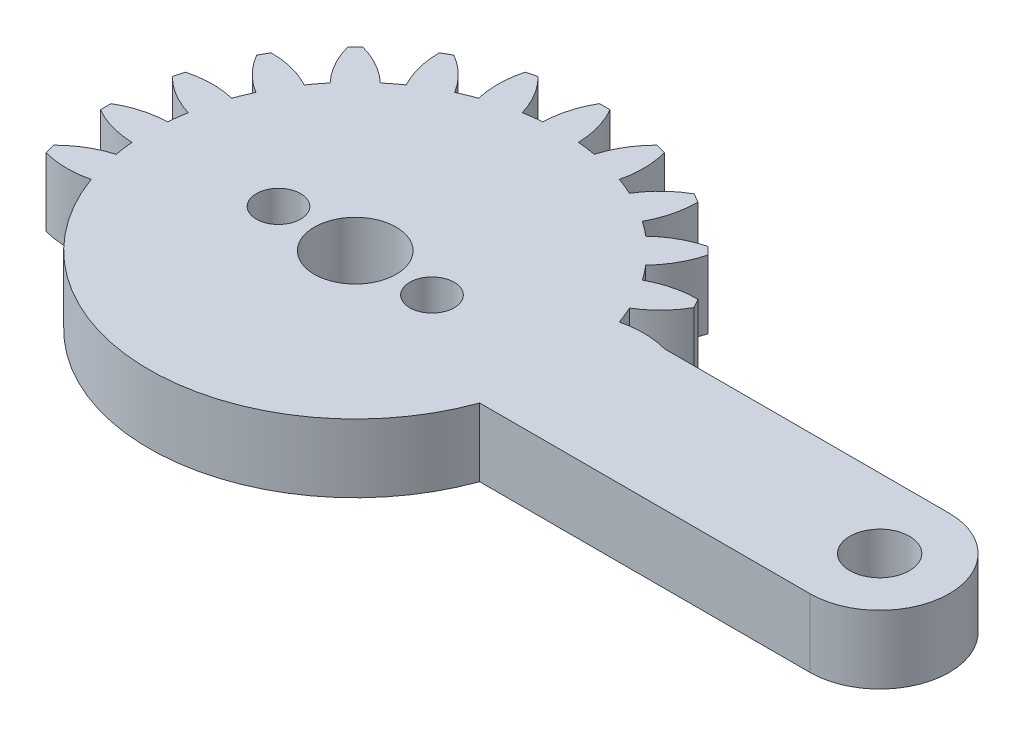
from build123d import *

# Parameters (mm, degrees)
SKETCH_2_R          = 1.75
EXTRUDE_1_DEPTH     = 4
SKETCH_3_R          = 2.4
SKETCH_3_R_2        = 1.3
CUT_EXTRUDE_1_DEPTH = 38.993706757


with BuildPart() as part:
    # 草图2 → 凸台-拉伸1 (new body)
    with BuildSketch(Plane(origin=(0, 0, 0), x_dir=(1, 0, 0), z_dir=(0, 1, 0))):
        with BuildLine():
            ThreePointArc((30.75, -4.085109489), (34.835109489, 0), (30.75, 4.085109489))
            Line((30.75, 4.085109489), (14.048088143, 4.085109489))
            ThreePointArc((14.048088143, 4.085109489), (12.709169027, 4.272836063), (11.365584201, 4.122086336))
            ThreePointArc((11.365584201, 4.122086336), (11.169703548, 4.626642697), (10.951436862, 5.12192646))
            ThreePointArc((10.951436862, 5.12192646), (12.008090957, 5.965388247), (12.82210701, 7.044889767))
            ThreePointArc((12.82210701, 7.044889767), (12.669951657, 7.315), (12.51210701, 7.581825517))
            ThreePointArc((12.51210701, 7.581825517), (11.170223244, 7.416617696), (9.911436862, 6.9232593))
            ThreePointArc((9.911436862, 6.9232593), (9.591641884, 7.359925677), (9.252623584, 7.781841479))
            ThreePointArc((9.252623584, 7.781841479), (10.05496909, 8.870045207), (10.561852666, 10.123446462))
            ThreePointArc((10.561852666, 10.123446462), (10.344972209, 10.344972209), (10.123446462, 10.561852666))
            ThreePointArc((10.123446462, 10.561852666), (8.870045207, 10.05496909), (7.781841479, 9.252623584))
            ThreePointArc((7.781841479, 9.252623584), (7.359925677, 9.591641884), (6.9232593, 9.911436862))
            ThreePointArc((6.9232593, 9.911436862), (7.416617696, 11.170223244), (7.581825517, 12.51210701))
            ThreePointArc((7.581825517, 12.51210701), (7.315, 12.669951657), (7.044889767, 12.82210701))
            ThreePointArc((7.044889767, 12.82210701), (5.965388247, 12.008090957), (5.12192646, 10.951436862))
            ThreePointArc((5.12192646, 10.951436862), (4.626642697, 11.169703548), (4.122086336, 11.365584201))
            ThreePointArc((4.122086336, 11.365584201), (4.272836063, 12.709169027), (4.085109489, 14.048088143))
            ThreePointArc((4.085109489, 14.048088143), (3.78652263, 14.131494839), (3.486235477, 14.208555951))
            ThreePointArc((3.486235477, 14.208555951), (2.654199937, 13.14288127), (2.112960617, 11.903927815))
            ThreePointArc((2.112960617, 11.903927815), (1.578061664, 11.986568374), (1.04, 12.04518576))
            ThreePointArc((1.04, 12.04518576), (0.837867713, 13.382005944), (0.31, 14.626715284))
            ThreePointArc((0.31, 14.626715284), (0, 14.63), (-0.31, 14.626715284))
            ThreePointArc((-0.31, 14.626715284), (-0.837867713, 13.382005944), (-1.04, 12.04518576))
            ThreePointArc((-1.04, 12.04518576), (-1.578061664, 11.986568374), (-2.112960617, 11.903927815))
            ThreePointArc((-2.112960617, 11.903927815), (-2.654199937, 13.14288127), (-3.486235477, 14.208555951))
            ThreePointArc((-3.486235477, 14.208555951), (-3.78652263, 14.131494839), (-4.085109489, 14.048088143))
            ThreePointArc((-4.085109489, 14.048088143), (-4.272836063, 12.709169027), (-4.122086336, 11.365584201))
            ThreePointArc((-4.122086336, 11.365584201), (-4.626642697, 11.169703548), (-5.12192646, 10.951436862))
            ThreePointArc((-5.12192646, 10.951436862), (-5.965388247, 12.008090957), (-7.044889767, 12.82210701))
            ThreePointArc((-7.044889767, 12.82210701), (-7.315, 12.669951657), (-7.581825517, 12.51210701))
            ThreePointArc((-7.581825517, 12.51210701), (-7.416617696, 11.170223244), (-6.9232593, 9.911436862))
            ThreePointArc((-6.9232593, 9.911436862), (-7.359925677, 9.591641884), (-7.781841479, 9.252623584))
            ThreePointArc((-7.781841479, 9.252623584), (-8.870045207, 10.05496909), (-10.123446462, 10.561852666))
            ThreePointArc((-10.123446462, 10.561852666), (-10.344972209, 10.344972209), (-10.561852666, 10.123446462))
            ThreePointArc((-10.561852666, 10.123446462), (-10.05496909, 8.870045207), (-9.252623584, 7.781841479))
            ThreePointArc((-9.252623584, 7.781841479), (-9.591641884, 7.359925677), (-9.911436862, 6.9232593))
            ThreePointArc((-9.911436862, 6.9232593), (-11.170223244, 7.416617696), (-12.51210701, 7.581825517))
            ThreePointArc((-12.51210701, 7.581825517), (-12.669951657, 7.315), (-12.82210701, 7.044889767))
            ThreePointArc((-12.82210701, 7.044889767), (-12.008090957, 5.965388247), (-10.951436862, 5.12192646))
            ThreePointArc((-10.951436862, 5.12192646), (-11.169703548, 4.626642697), (-11.365584201, 4.122086336))
            ThreePointArc((-11.365584201, 4.122086336), (-12.709169027, 4.272836063), (-14.048088143, 4.085109489))
            ThreePointArc((-14.048088143, 4.085109489), (-14.131494839, 3.78652263), (-14.208555951, 3.486235477))
            ThreePointArc((-14.208555951, 3.486235477), (-13.14288127, 2.654199937), (-11.903927815, 2.112960617))
            ThreePointArc((-11.903927815, 2.112960617), (-11.986568374, 1.578061664), (-12.04518576, 1.04))
            ThreePointArc((-12.04518576, 1.04), (-13.382005944, 0.837867713), (-14.626715284, 0.31))
            ThreePointArc((-14.626715284, 0.31), (-14.63, 0), (-14.626715284, -0.31))
            ThreePointArc((-14.626715284, -0.31), (-13.382005944, -0.837867713), (-12.04518576, -1.04))
            ThreePointArc((-12.04518576, -1.04), (-11.986568374, -1.578061664), (-11.903927815, -2.112960617))
            ThreePointArc((-11.903927815, -2.112960617), (-13.14288127, -2.654199937), (-14.208555951, -3.486235477))
            ThreePointArc((-14.208555951, -3.486235477), (-14.131494839, -3.78652263), (-14.048088143, -4.085109489))
            ThreePointArc((-14.048088143, -4.085109489), (-12.709169027, -4.272836063), (-11.365584201, -4.122086336))
            ThreePointArc((-11.365584201, -4.122086336), (0.019655269, -12.089984023), (11.378927035, -4.085109489))
            Line((11.378927035, -4.085109489), (30.75, -4.085109489))
        make_face()
        with Locations(Location((0, 0, 0), (0, 0, 270))):
            Circle(SKETCH_2_R, mode=Mode.SUBTRACT)
        with Locations(Location((30.75, 0, 0), (0, 0, 270))):
            Circle(SKETCH_2_R, mode=Mode.SUBTRACT)
    extrude(amount=EXTRUDE_1_DEPTH)

    # 草图3 → 切除-拉伸1 (cut, through all)
    with BuildSketch(Plane(origin=(0, 4, 0), x_dir=(1, 0, 0), z_dir=(0, 1, 0))):
        with Locations(Location((0, 0, 0), (0, 0, 270))):
            Circle(SKETCH_3_R)
        with Locations(Location((4.5, 0, 0), (0, 0, 270))):
            Circle(SKETCH_3_R_2)
        with Locations(Location((-4.5, 0, 0), (0, 0, 270))):
            Circle(SKETCH_3_R_2)
    extrude(amount=-CUT_EXTRUDE_1_DEPTH, mode=Mode.SUBTRACT)


solid = part.part
